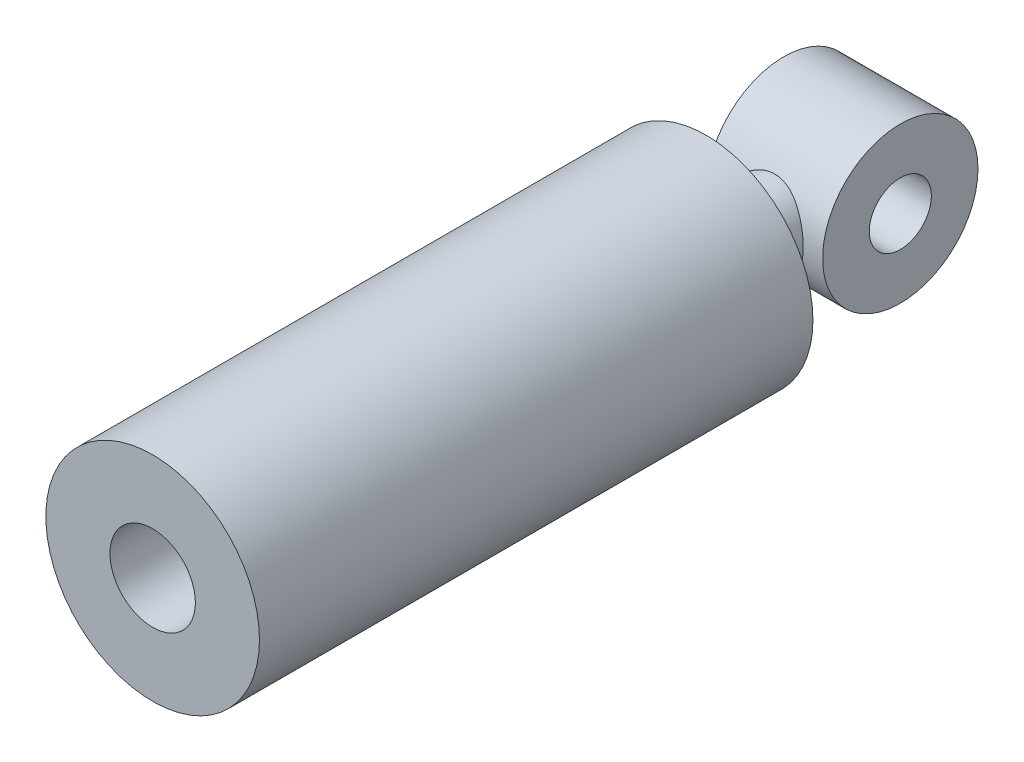
from build123d import *

# Parameters (mm, degrees)
EYE_SKETCH_R       = 4
EYE_EXTRUDE_DEPTH  = 3
EYE_BORE_SKETCH_R  = 1.6
EYE_BORE_CUT_DEPTH = 3


with BuildPart() as part:
    # Cylinder Section → Cylinder Revolve (revolve)
    with BuildSketch(Plane(origin=(0, 0, 0), x_dir=(1, 0, 0), z_dir=(0, 1, 0))):
        Polygon((0, -3), (2, -3), (2, -7), (5.5, -7), (5.5, -35.5), (2.2, -35.5), (2.2, -12), (0, -12), align=None)
    revolve(axis=Axis((0, 0, 10.123), (0, 0, -1)))

    # Eye Sketch → Eye Extrude (add, symmetric)
    with BuildSketch(Plane(origin=(0, 0, 0), x_dir=(0, 0, -1), z_dir=(1, 0, 0))):
        Circle(EYE_SKETCH_R)
    extrude(amount=EYE_EXTRUDE_DEPTH, both=True)

    # Eye Bore Sketch → Eye Bore Cut (cut, symmetric)
    with BuildSketch(Plane(origin=(0, 0, 0), x_dir=(0, 0, -1), z_dir=(1, 0, 0))):
        Circle(EYE_BORE_SKETCH_R)
    extrude(amount=EYE_BORE_CUT_DEPTH, both=True, mode=Mode.SUBTRACT)


solid = part.part
